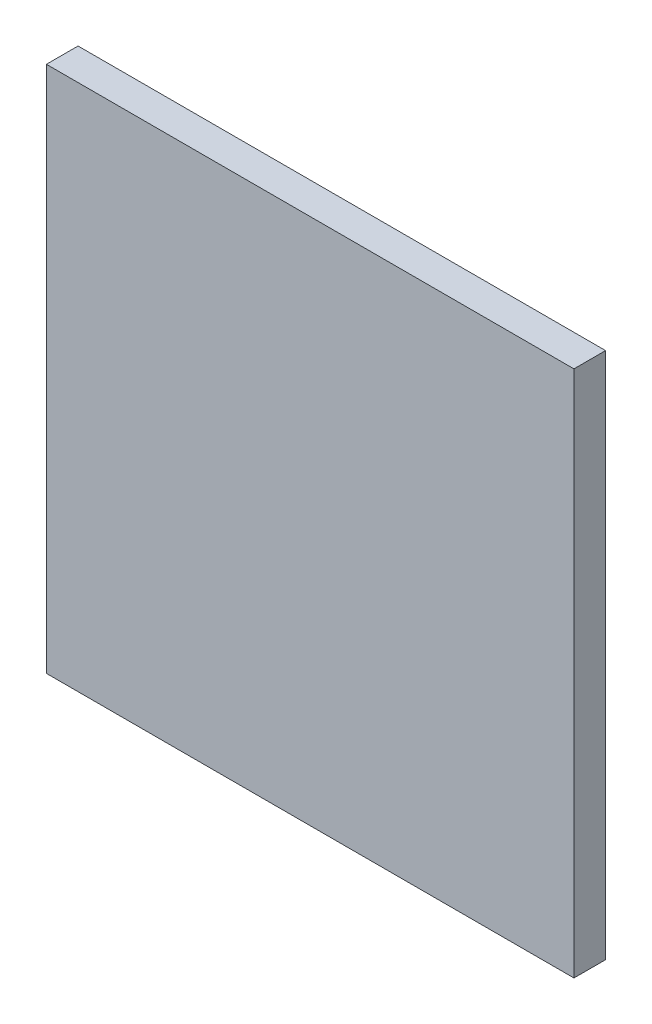
from build123d import *

# Parameters (mm, degrees)
SKETCH_1_W      = 50
SKETCH_1_H      = 50
EXTRUDE_1_DEPTH = 3


with BuildPart() as part:
    # 草图1 → 凸台-拉伸1 (new body)
    with BuildSketch(Plane.XY):
        with Locations((25, 25)):
            Rectangle(SKETCH_1_W, SKETCH_1_H)
    extrude(amount=EXTRUDE_1_DEPTH)


solid = part.part
